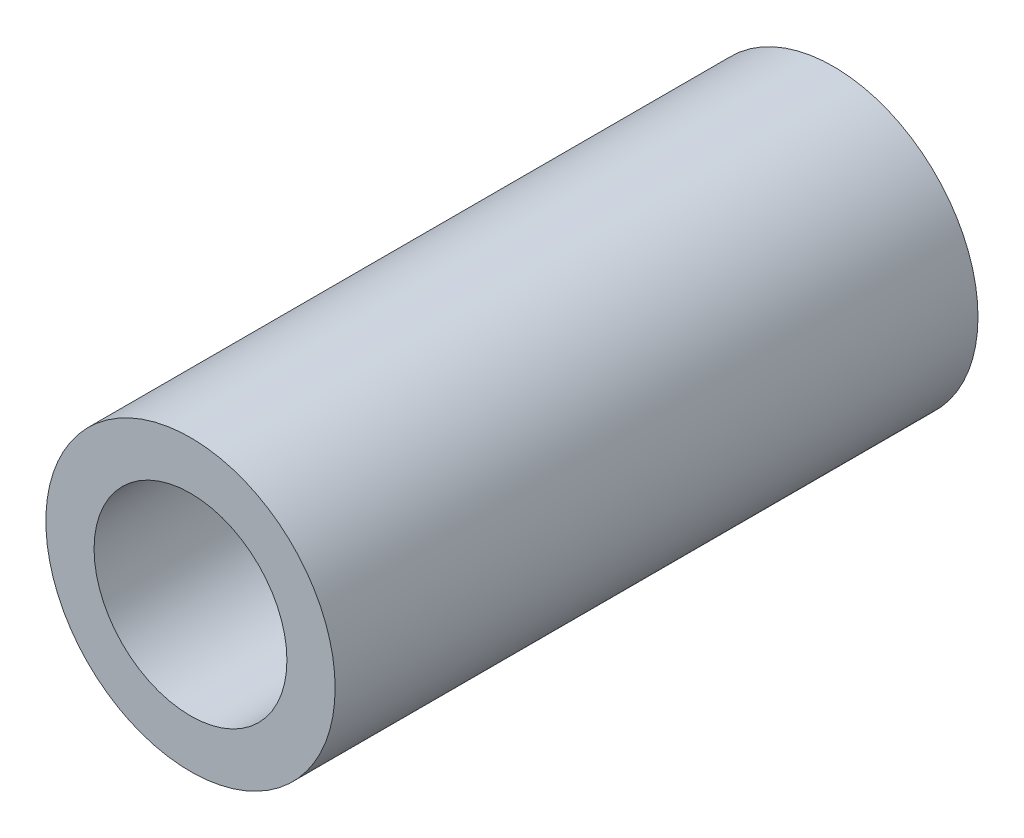
from build123d import *

# Parameters (mm, degrees)
SKETCH_1_R          = 4.5
EXTRUDE_1_DEPTH     = 20
SKETCH_2_R          = 3
CUT_EXTRUDE_1_DEPTH = 21.988091862


with BuildPart() as part:
    # 草图1 → 凸台-拉伸1 (new body)
    with BuildSketch(Plane.XY):
        Circle(SKETCH_1_R)
    extrude(amount=EXTRUDE_1_DEPTH)

    # 草图2 → 切除-拉伸1 (cut, through all)
    with BuildSketch(Plane(origin=(0, 0, 0), x_dir=(-1, 0, 0), z_dir=(0, 0, -1))):
        Circle(SKETCH_2_R)
    extrude(amount=-CUT_EXTRUDE_1_DEPTH, mode=Mode.SUBTRACT)


solid = part.part
